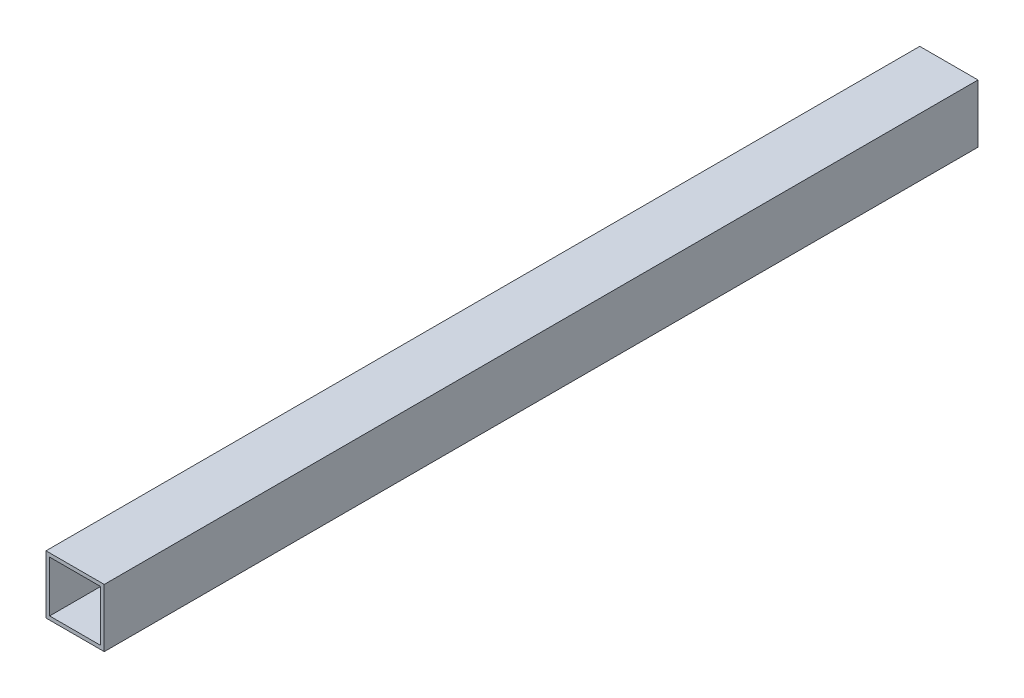
from build123d import *

# Parameters (mm, degrees)
SKETCH1_W           = 25.4
SKETCH1_H           = 381
BOSS_EXTRUDE1_DEPTH = 25.4
SKETCH3_W           = 22.225
SKETCH3_H           = 22.225
CUT_EXTRUDE2_DEPTH  = 381


with BuildPart() as part:
    # Sketch1 → Boss-Extrude1 (new body)
    with BuildSketch(Plane(origin=(0, 0, 0), x_dir=(1, 0, 0), z_dir=(0, 1, 0))):
        Rectangle(SKETCH1_W, SKETCH1_H)
    extrude(amount=BOSS_EXTRUDE1_DEPTH)

    # Sketch3 → Cut-Extrude2 (cut)
    with BuildSketch(Plane.XY.offset(190.5)):
        with Locations((0, 12.7)):
            Rectangle(SKETCH3_W, SKETCH3_H)
    extrude(amount=-CUT_EXTRUDE2_DEPTH, mode=Mode.SUBTRACT)


solid = part.part
